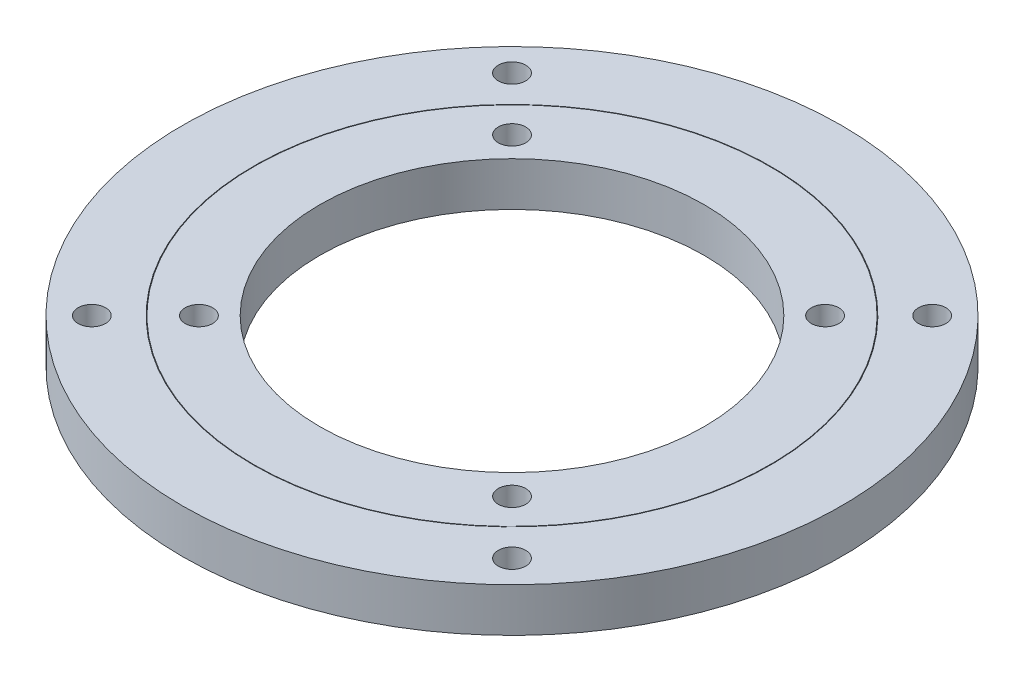
from build123d import *

# Parameters (mm, degrees)
SKETCH1_R           = 47
SKETCH1_R_2         = 2.5
SKETCH1_R_3         = 35
BOSS_EXTRUDE2_DEPTH = 8
SKETCH1_4_R         = 60
SKETCH1_4_R_2       = 2.5
SKETCH1_4_R_3       = 47.1
BOSS_EXTRUDE3_DEPTH = 8


with BuildPart() as part:
    # Sketch1 → Boss-Extrude2 (new body)
    with BuildSketch(Plane(origin=(0, 0, 0), x_dir=(1, 0, 0), z_dir=(0, 1, 0))):
        with Locations(Location((0, 0, 0), (0, 0, 270))):
            Circle(SKETCH1_R)
        with Locations(Location((28.5, -28.5, 0), (0, 0, 270))):
            Circle(SKETCH1_R_2, mode=Mode.SUBTRACT)
        with Locations(Location((-28.5, 28.5, 0), (0, 0, 270))):
            Circle(SKETCH1_R_2, mode=Mode.SUBTRACT)
        with Locations(Location((28.5, 28.5, 0), (0, 0, 270))):
            Circle(SKETCH1_R_2, mode=Mode.SUBTRACT)
        with Locations(Location((0, 0, 0), (0, 0, 270))):
            Circle(SKETCH1_R_3, mode=Mode.SUBTRACT)
        with Locations(Location((-28.5, -28.5, 0), (0, 0, 270))):
            Circle(SKETCH1_R_2, mode=Mode.SUBTRACT)
    extrude(amount=BOSS_EXTRUDE2_DEPTH)


with BuildPart() as body_2:
    # Sketch1<4> → Boss-Extrude3 (new body)
    with BuildSketch(Plane(origin=(0, 0, 0), x_dir=(1, 0, 0), z_dir=(0, 1, 0))):
        with Locations(Location((0, 0, 0), (0, 0, 270))):
            Circle(SKETCH1_4_R)
        with Locations(Location((-38.25, 38.25, 0), (0, 0, 270))):
            Circle(SKETCH1_4_R_2, mode=Mode.SUBTRACT)
        with Locations(Location((38.25, 38.25, 0), (0, 0, 270))):
            Circle(SKETCH1_4_R_2, mode=Mode.SUBTRACT)
        with Locations(Location((38.25, -38.25, 0), (0, 0, 270))):
            Circle(SKETCH1_4_R_2, mode=Mode.SUBTRACT)
        with Locations(Location((-38.25, -38.25, 0), (0, 0, 270))):
            Circle(SKETCH1_4_R_2, mode=Mode.SUBTRACT)
        with Locations(Location((0, 0, 0), (0, 0, 270))):
            Circle(SKETCH1_4_R_3, mode=Mode.SUBTRACT)
    extrude(amount=BOSS_EXTRUDE3_DEPTH)


solid = Compound([part.part, body_2.part])
